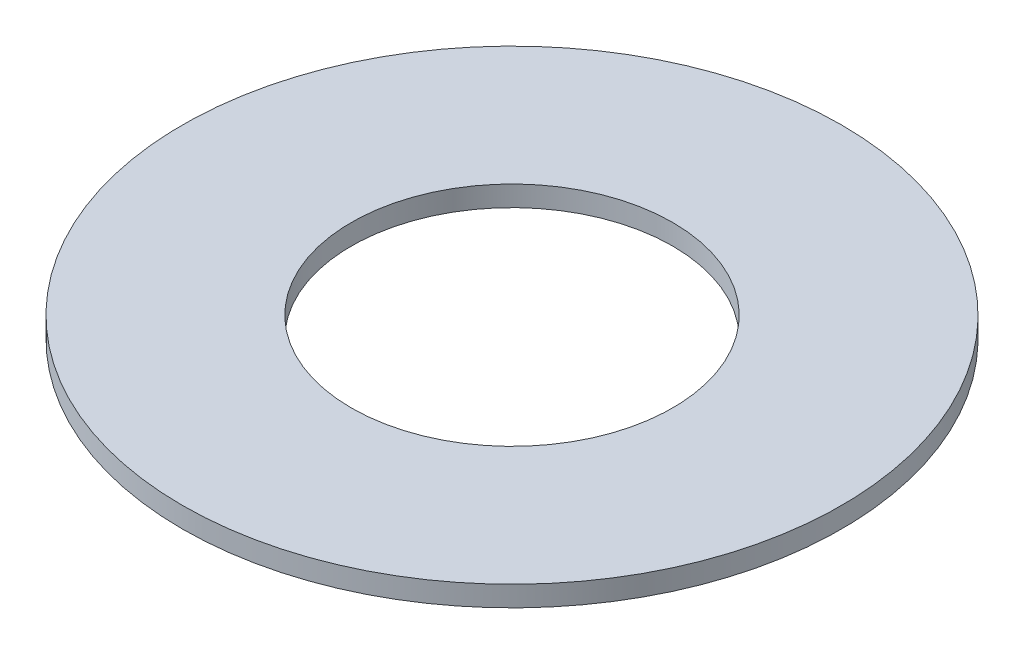
from build123d import *

# Parameters (mm, degrees)
SKETCH1_R           = 32.2
SKETCH1_R_2         = 15.7
BOSS_EXTRUDE1_DEPTH = 2


with BuildPart() as part:
    # Sketch1 → Boss-Extrude1 (new body)
    with BuildSketch(Plane(origin=(0, 0, 0), x_dir=(1, 0, 0), z_dir=(0, 1, 0))):
        with Locations(Location((0, 0, 0), (0, 0, 270))):
            Circle(SKETCH1_R)
        with Locations(Location((0, 0, 0), (0, 0, 270))):
            Circle(SKETCH1_R_2, mode=Mode.SUBTRACT)
    extrude(amount=BOSS_EXTRUDE1_DEPTH)


solid = part.part
